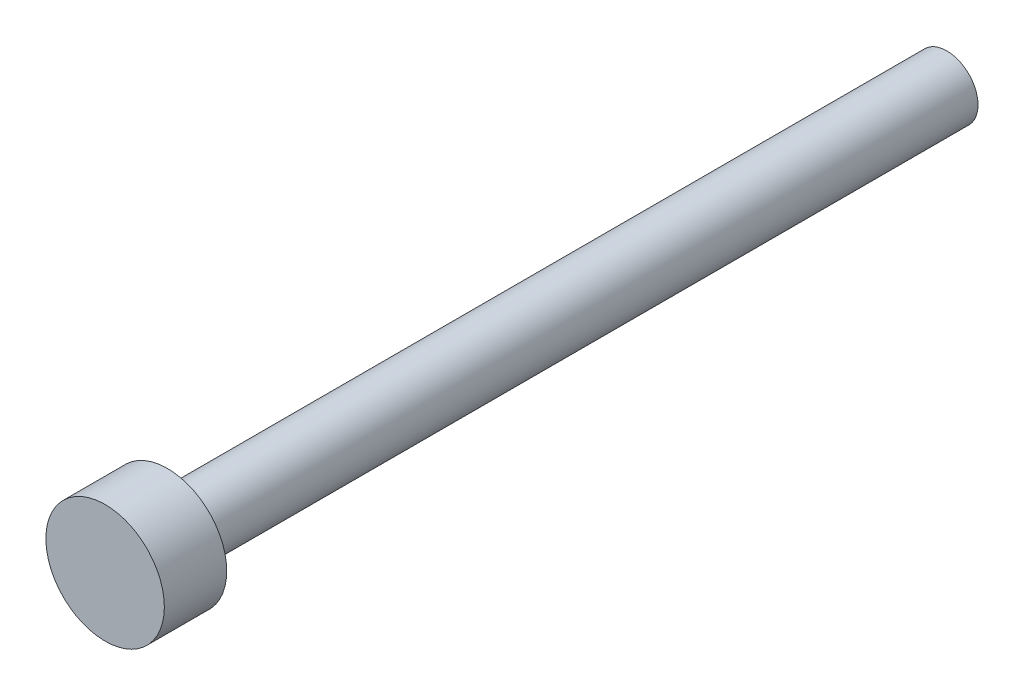
from build123d import *

# Parameters (mm, degrees)
SHANK_NOMINAL_THREAD_ENVELOPE_START     = -25
SHANK_NOMINAL_THREAD_ENVELOPE_PROFILE_R = 1
SHANK_NOMINAL_THREAD_ENVELOPE_DEPTH     = 25
SOCKET_HEAD_ENVELOPE_PROFILE_R          = 1.9
SOCKET_HEAD_ENVELOPE_DEPTH              = 2


with BuildPart() as part:
    # Shank_nominal_thread_envelope_profile → Shank_nominal_thread_envelope (new body)
    with BuildSketch(Plane.XY.offset(SHANK_NOMINAL_THREAD_ENVELOPE_START)):
        Circle(SHANK_NOMINAL_THREAD_ENVELOPE_PROFILE_R)
    extrude(amount=SHANK_NOMINAL_THREAD_ENVELOPE_DEPTH)

    # Socket_head_envelope_profile → Socket_head_envelope (add)
    with BuildSketch(Plane.XY):
        Circle(SOCKET_HEAD_ENVELOPE_PROFILE_R)
    extrude(amount=SOCKET_HEAD_ENVELOPE_DEPTH)


solid = part.part
